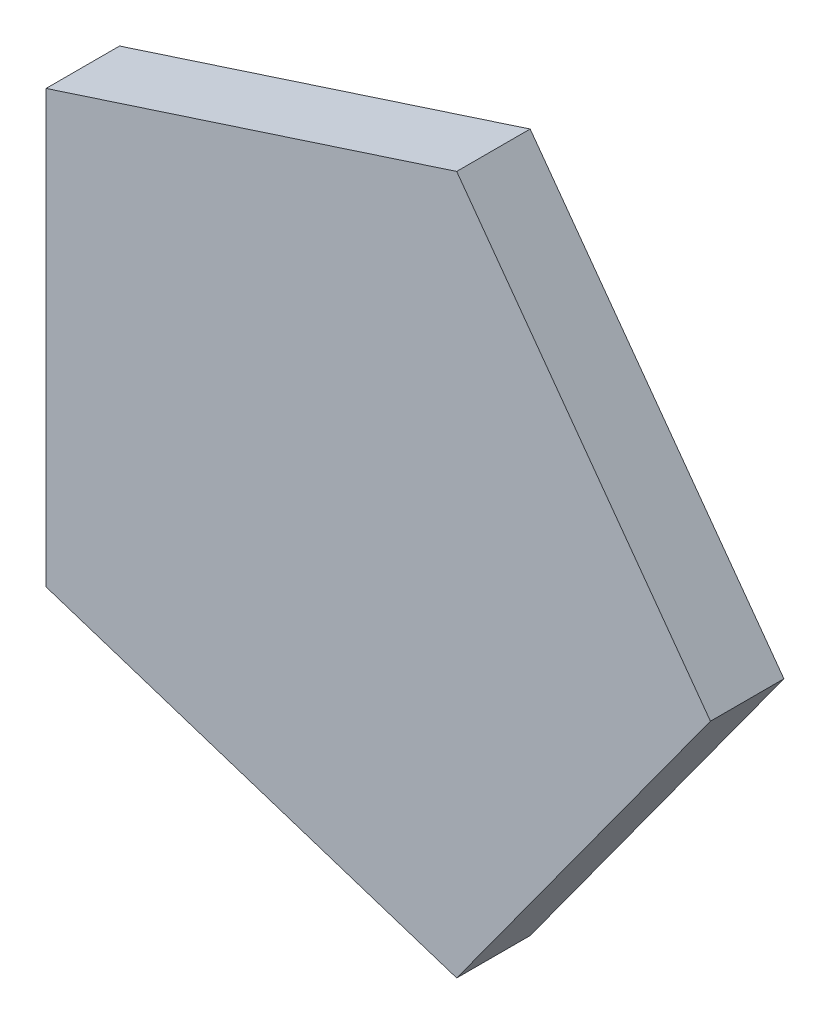
from build123d import *

# Parameters (mm, degrees)
EXTRUDE_1_DEPTH = 100


with BuildPart() as part:
    # 草图1 → 凸台-拉伸1 (new body)
    with BuildSketch(Plane.XY):
        Polygon((500, 0), (154.508497187, 475.528258148), (-404.508497187, 293.892626146), (-404.508497187, -293.892626146), (154.508497187, -475.528258148), align=None)
    extrude(amount=EXTRUDE_1_DEPTH)


solid = part.part
